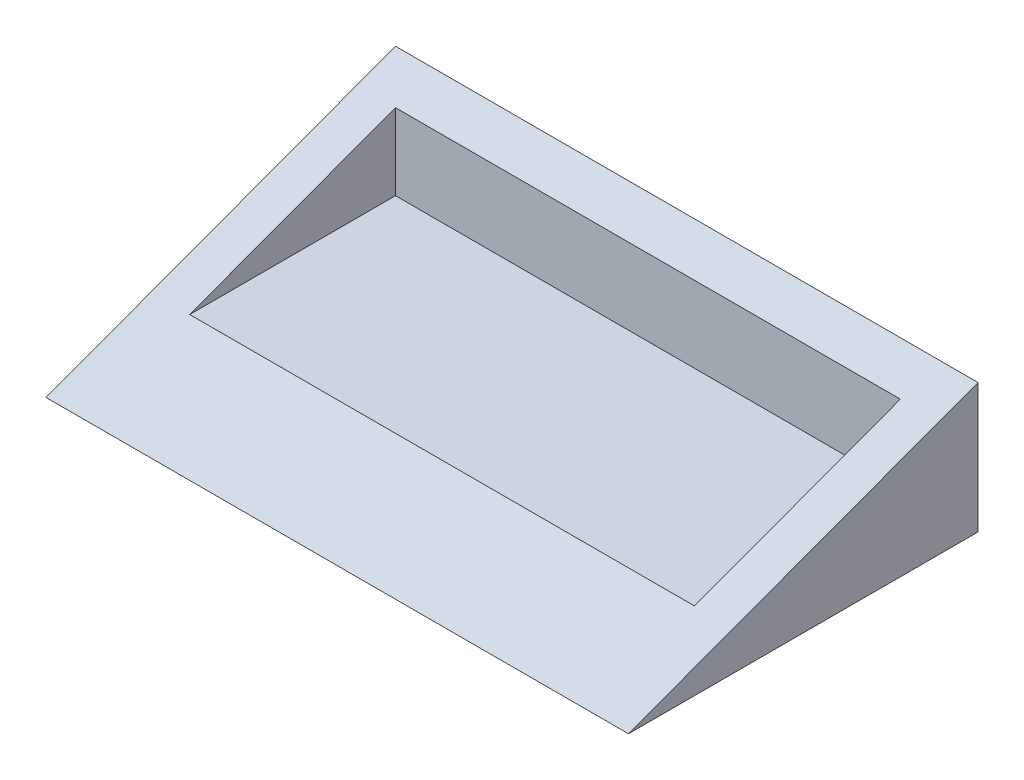
from build123d import *

# Parameters (mm, degrees)
SALIENTE_EXTRUIR1_DEPTH = 45
VACIADO1_T              = -3


with BuildPart() as part:
    # Croquis1 → Saliente-Extruir1 (new body)
    with BuildSketch(Plane(origin=(0, 0, 0), x_dir=(0, 0, -1), z_dir=(1, 0, 0))):
        Polygon((0, 0), (27, 10), (27, 0), align=None)
    extrude(amount=SALIENTE_EXTRUIR1_DEPTH)

    # Vaciado1
    vaciado1_openings = [part.faces().sort_by_distance(p)[0] for p in [
        (22.5, 5, -13.5),
    ]]
    offset(amount=VACIADO1_T, openings=vaciado1_openings, kind=Kind.INTERSECTION)


solid = part.part
